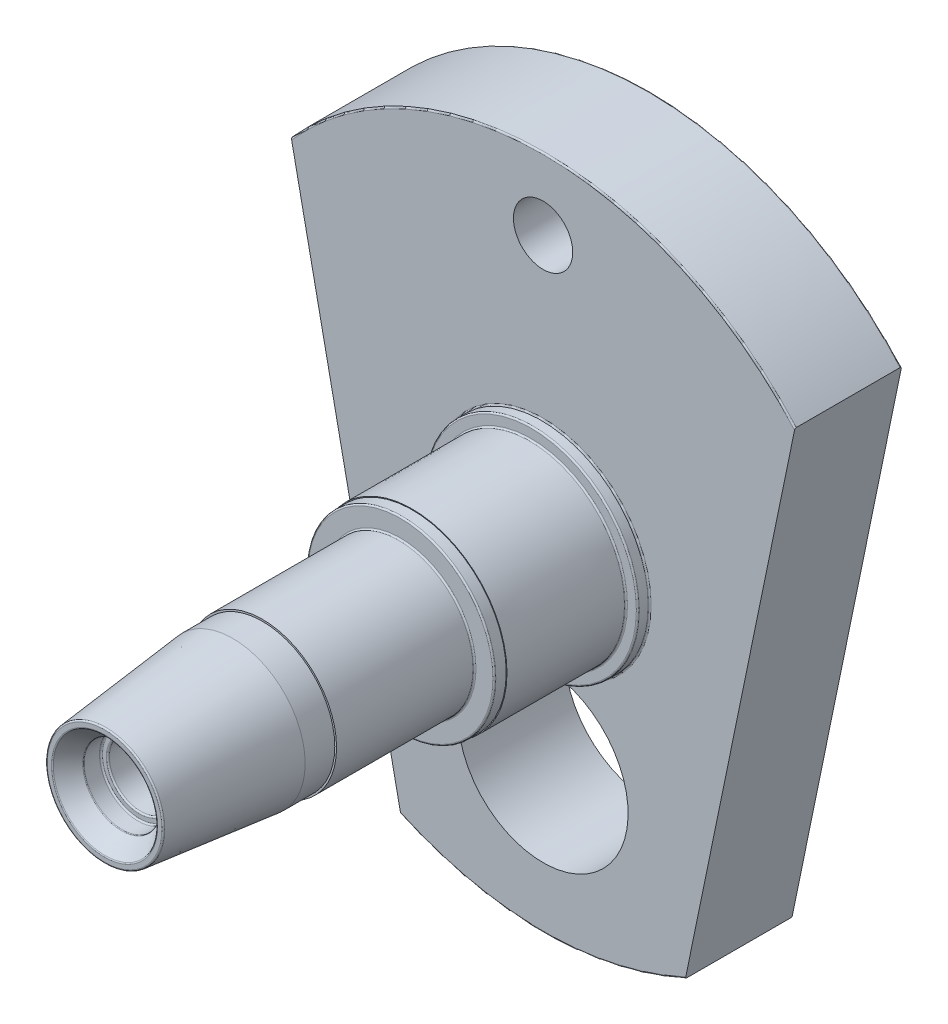
from build123d import *

# Parameters (mm, degrees)
SKETCH2_OUTSIDE_W   = 153.124
SKETCH2_OUTSIDE_H   = 153.124
SKETCH2_OUTSIDE_R   = 14.350000000000007
SKETCH2_OUTSIDE_R_2 = 4.999999999999991
CUT_EXTRUDE1_DEPTH  = 30


with BuildPart() as part:
    # Sketch1 → Revolve1 (revolve)
    with BuildSketch(Plane(origin=(0, 0, 0), x_dir=(0, 0, -1), z_dir=(1, 0, 0)), mode=Mode.PRIVATE) as revolve1_sk:
        with BuildLine():
            Line((92, 6.305), (91.00000000000003, 5.305000000000007))
            Line((91.00000000000003, 5.305000000000007), (6.120000000000002, 5.305))
            ThreePointArc((6.120000000000002, 5.305), (5.943223304703364, 5.378223304703363), (5.87, 5.5550000000000015))
            Line((5.87, 5.5550000000000015), (5.87, 6.219999999999998))
            ThreePointArc((5.87, 6.219999999999998), (5.796776695296637, 6.396776695296636), (5.619999999999998, 6.47))
            Line((5.619999999999998, 6.47), (3.0231877685493473, 6.47))
            ThreePointArc((3.0231877685493473, 6.47), (2.9400225945826715, 6.484238353757248), (2.8663305019537604, 6.5253315692872595))
            Line((2.8663305019537604, 6.5253315692872595), (0.09314273340441587, 8.75987289444363))
            ThreePointArc((0.09314273340441587, 8.75987289444363), (0.02448468272765195, 8.846639324824814), (3.7e-16, 8.954541325156374))
            Line((3.7e-16, 8.954541325156374), (4.2e-16, 9.675152100147892))
            ThreePointArc((4.2e-16, 9.675152100147892), (0.0641202416662966, 9.842330793293295), (0.22358972353443296, 9.923753180791186))
            Line((0.22358972353443296, 9.923753180791186), (21.650000000000002, 12.2))
            Line((21.650000000000002, 12.2), (26.65, 12.2))
            Line((26.65, 12.2), (26.65, 12.5))
            Line((26.65, 12.5), (49.68, 12.5))
            ThreePointArc((49.68, 12.5), (49.85677669529664, 12.573223304703363), (49.93, 12.750000000000002))
            Line((49.93, 12.750000000000002), (49.93, 15.599999999999998))
            ThreePointArc((49.93, 15.599999999999998), (50.00322330470336, 15.776776695296636), (50.18, 15.85))
            Line((50.18, 15.85), (51.93000000000001, 15.85))
            Line((51.93000000000001, 15.85), (51.93000000000001, 15.98094888416447))
            Line((51.93000000000001, 15.98094888416447), (71.7501186105072, 15.990352382508174))
            ThreePointArc((71.7501186105072, 15.990352382508174), (71.92681862547084, 16.063617599196743), (72, 16.240352354371268))
            Line((72, 16.240352354371268), (72, 17.740470936754917))
            ThreePointArc((72, 17.740470936754917), (72.07322330470336, 17.917247632051556), (72.25, 17.990470936754917))
            Line((72.25, 17.990470936754917), (73.75, 17.990470936754917))
            ThreePointArc((73.75, 17.990470936754917), (73.92677669529664, 18.06369424145828), (74, 18.240470936754917))
            Line((74, 18.240470936754917), (74, 56.75))
            ThreePointArc((74, 56.75), (74.07322330470336, 56.92677669529664), (74.25, 57))
            Line((74.25, 57), (91.75, 57))
            ThreePointArc((91.75, 57), (91.92677669529664, 56.92677669529664), (92, 56.75))
            Line((92, 56.75), (92, 6.305))
        make_face()
    revolve(revolve1_sk.sketch.rotate(Axis((0, 0, 0), (0, 0, -1)), 90), axis=Axis((0, 0, 0), (0, 0, -1)))

    # Sketch2 outside → Cut-Extrude1 (cut)
    # profile 1 of 3: a face of its own
    with BuildSketch(Plane(origin=(0, 0, -92), x_dir=(-1, 0, 0), z_dir=(0, 0, -1))):
        Rectangle(SKETCH2_OUTSIDE_W, SKETCH2_OUTSIDE_H)
        with BuildLine():
            Line((42.50025155362119, 37.98326760402424), (24.016363121908466, -51.693464793885056))
            ThreePointArc((24.016363121908466, -51.693464793885056), (3.49e-15, -56.999999999999986), (-24.016363121908466, -51.693464793885056))
            Line((-24.016363121908466, -51.693464793885056), (-42.50025155362119, 37.98326760402424))
            ThreePointArc((-42.50025155362119, 37.98326760402424), (3.49e-15, 56.99999999999998), (42.50025155362119, 37.98326760402424))
        make_face(mode=Mode.SUBTRACT)
    # profile 2 of 3: a face of its own
    with BuildSketch(Plane(origin=(0, 0, -92), x_dir=(-1, 0, 0), z_dir=(0, 0, -1))):
        with Locations((0, -32.4)):
            Circle(SKETCH2_OUTSIDE_R)
    # profile 3 of 3: a face of its own
    with BuildSketch(Plane(origin=(0, 0, -92), x_dir=(-1, 0, 0), z_dir=(0, 0, -1))):
        with Locations((0, 44.95)):
            Circle(SKETCH2_OUTSIDE_R_2)
    extrude(amount=-CUT_EXTRUDE1_DEPTH, mode=Mode.SUBTRACT)


solid = part.part
